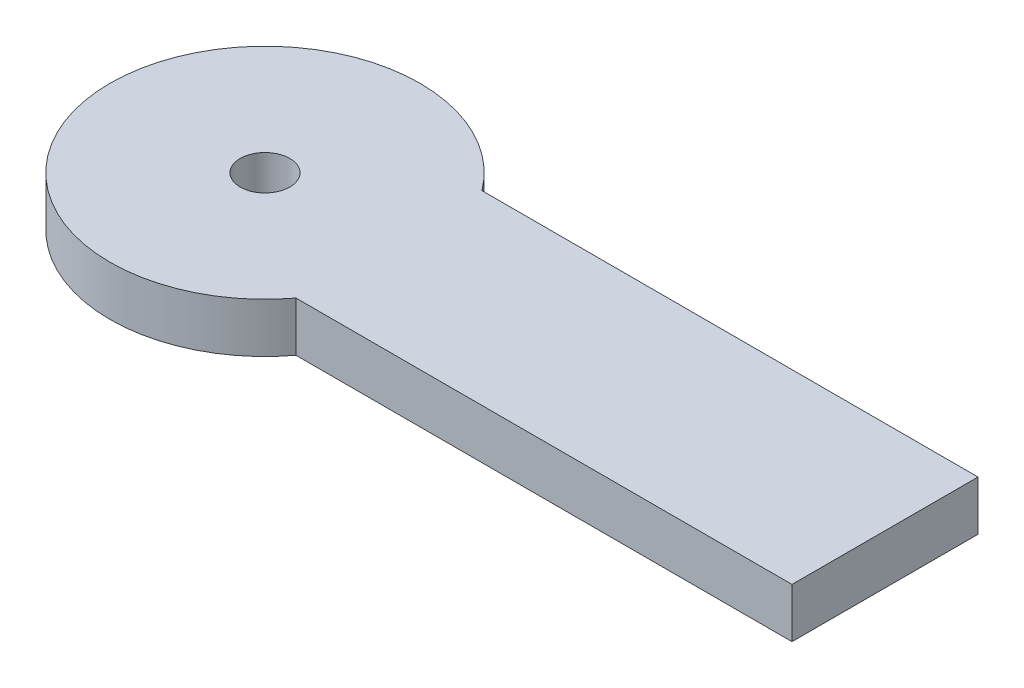
from build123d import *

# Parameters (mm, degrees)
SKETCH1_R           = 2
BOSS_EXTRUDE1_DEPTH = 4


with BuildPart() as part:
    # Sketch1 → Boss-Extrude1 (new body)
    with BuildSketch(Plane(origin=(0, 0, 0), x_dir=(1, 0, 0), z_dir=(0, 1, 0))):
        with BuildLine():
            Line((10, 7.5), (50, 7.5))
            Line((50, 7.5), (50, -7.5))
            Line((50, -7.5), (10, -7.5))
            ThreePointArc((10, -7.5), (-12.5, 0), (10, 7.5))
        make_face()
        with Locations(Location((0, 0, 0), (0, 0, 270))):
            Circle(SKETCH1_R, mode=Mode.SUBTRACT)
    extrude(amount=BOSS_EXTRUDE1_DEPTH)


solid = part.part
